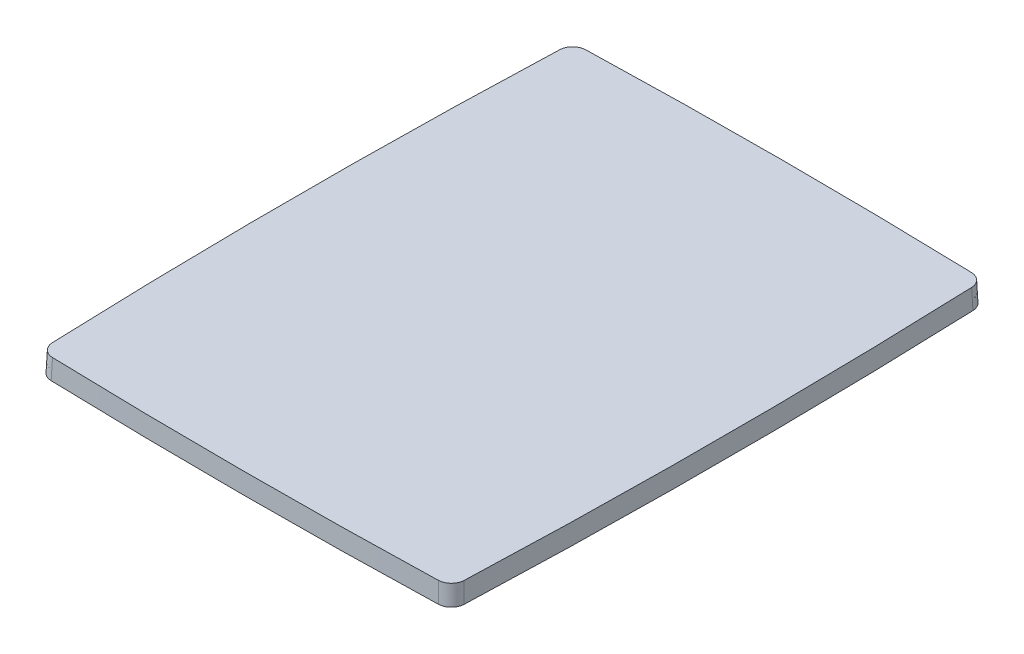
from build123d import *

# Parameters (mm, degrees)
BOSS_EXTRUDE1_DEPTH = 1.5
BOSS_EXTRUDE1_TAPER = 2
FILLET1_R           = 1


with BuildPart() as part:
    # Sketch1 → Boss-Extrude1 (new body)
    with BuildSketch(Plane(origin=(0, 0, 0), x_dir=(1, 0, 0), z_dir=(0, 1, 0))):
        with BuildLine():
            ThreePointArc((-15.398991588, 19.940901099), (-15.8, 0), (-15.398991588, -19.940901099))
            ThreePointArc((-15.398991588, -19.940901099), (0, -20.18), (15.398991588, -19.940901099))
            ThreePointArc((15.398991588, -19.940901099), (15.8, 0), (15.398991588, 19.940901099))
            ThreePointArc((15.398991588, 19.940901099), (0, 20.18), (-15.398991588, 19.940901099))
        make_face()
    extrude(amount=BOSS_EXTRUDE1_DEPTH, taper=BOSS_EXTRUDE1_TAPER)

    # Fillet1
    fillet1_edges = [part.edges().sort_by_distance(p)[0] for p in [
        (15.373801496, 0.75, -19.915479128),
        (15.373801497, 0.75, 19.915479128),
        (-15.373801496, 0.75, 19.915479128),
        (-15.373801496, 0.75, -19.915479128),
    ]]
    fillet(fillet1_edges, radius=FILLET1_R)


solid = part.part
